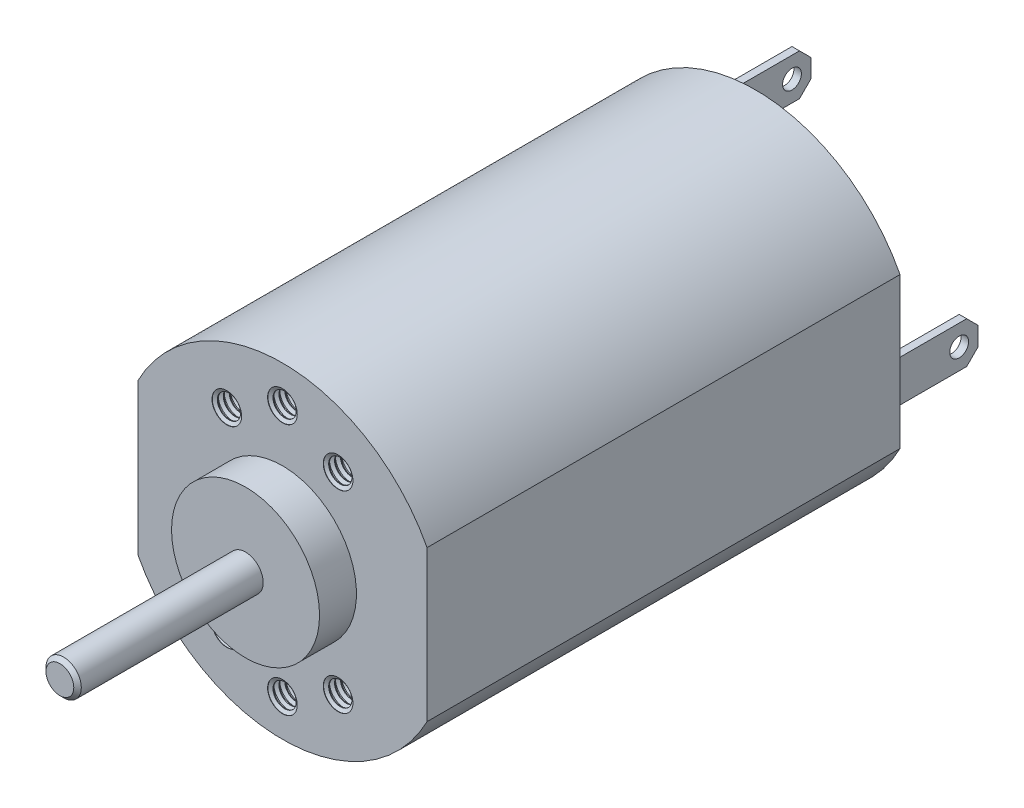
from build123d import *

# Parameters (mm, degrees)
SKETCH1_R            = 4.9911
EXTRUDE1_DEPTH       = 2.4892
EXTRUDE2_DEPTH       = 31.9024
SKETCH3_R            = 1.190625
EXTRUDE3_DEPTH       = 15.0114
SKETCH4_W            = 0.508
SKETCH4_H            = 2.794
EXTRUDE4_DEPTH       = 9.1186
SKETCH5_R            = 0.635
CUT_EXTRUDE1_DEPTH   = 46.087182201
LPATTERN1_COUNT      = 2
LPATTERN1_PITCH      = 11.2776
LPATTERN1_COUNT_DIR2 = 2
LPATTERN1_PITCH_DIR2 = 10.0076
CIRPATTERN1_COUNT    = 2
CIRPATTERN2_COUNT    = 6
CHAMFER1_SIZE        = 0.254


with BuildPart() as part:
    # Sketch1 → Extrude1 (new body)
    with BuildSketch(Plane.XY):
        Circle(SKETCH1_R)
    extrude(amount=EXTRUDE1_DEPTH)

    # Sketch2 → Extrude2 (add)
    with BuildSketch(Plane(origin=(0, 0, 0), x_dir=(-1, 0, 0), z_dir=(0, 0, -1))):
        with BuildLine():
            Line((-9.7536, 5.082095068), (-9.7536, -5.082095068))
            ThreePointArc((-9.7536, -5.082095068), (0, -10.9982), (9.7536, -5.082095068))
            Line((9.7536, -5.082095068), (9.7536, 5.082095068))
            ThreePointArc((9.7536, 5.082095068), (0, 10.9982), (-9.7536, 5.082095068))
        make_face()
    extrude(amount=EXTRUDE2_DEPTH)

    # Sketch3 → Extrude3 (add)
    with BuildSketch(Plane.XY):
        Circle(SKETCH3_R)
    extrude(amount=EXTRUDE3_DEPTH)

    # Sketch4 → Extrude4 (add)
    with BuildSketch(Plane(origin=(0, 0, -31.9024), x_dir=(-1, 0, 0), z_dir=(0, 0, -1))):
        with Locations((5.6388, 5.0038)):
            Rectangle(SKETCH4_W, SKETCH4_H)
    extrude4 = extrude(amount=EXTRUDE4_DEPTH)

    # Sketch5 → Cut-Extrude1 (cut, through all)
    with BuildSketch(Plane(origin=(-5.3848, 0, 0), x_dir=(0, 0, -1), z_dir=(1, 0, 0))):
        with Locations((39.751, 5.0038)):
            Circle(SKETCH5_R)
        Polygon((40.259, 6.4008), (41.021, 6.4008), (41.021, 5.6388), align=None)
        Polygon((40.259, 3.6068), (41.021, 3.6068), (41.021, 4.3688), align=None)
    cut_extrude1 = extrude(amount=-CUT_EXTRUDE1_DEPTH, mode=Mode.SUBTRACT)

    # LPattern1: Extrude4, Cut-Extrude1 2 × 2, 2 skipped
    with Locations(*[(i * LPATTERN1_PITCH, -j * LPATTERN1_PITCH_DIR2, 0) for i in range(LPATTERN1_COUNT) for j in range(LPATTERN1_COUNT_DIR2) if (i, j) not in ((0, 0), (0, 1), (1, 0))]):
        add(extrude4)
        add(cut_extrude1, mode=Mode.SUBTRACT)

    # Sketch7 → Cut-Revolve1 (revolve, cut)
    with BuildSketch(Plane(origin=(0, 0, 0), x_dir=(0, 0, -1), z_dir=(1, 0, 0)), mode=Mode.PRIVATE) as cut_revolve1_sk:
        Polygon((-0.2028, 8.4963), (2.9972, 8.4963), (2.9972, 9.279793649), (2.9472, 9.279793649), (2.8222, 9.4963), (2.7222, 9.4963), (2.5972, 9.279793649), (2.5472, 9.279793649), (2.4222, 9.4963), (2.3222, 9.4963), (2.1972, 9.279793649), (2.1472, 9.279793649), (2.0222, 9.4963), (1.9222, 9.4963), (1.7972, 9.279793649), (1.7472, 9.279793649), (1.6222, 9.4963), (1.5222, 9.4963), (1.3972, 9.279793649), (1.3472, 9.279793649), (1.2222, 9.4963), (1.1222, 9.4963), (0.9972, 9.279793649), (0.9472, 9.279793649), (0.8222, 9.4963), (0.7222, 9.4963), (0.5972, 9.279793649), (0.5472, 9.279793649), (0.4222, 9.4963), (0.3222, 9.4963), (0.1972, 9.279793649), (0.1472, 9.279793649), (0.0222, 9.4963), (-0.0778, 9.4963), (-0.2028, 9.279793649), align=None)
    cut_revolve1 = revolve(cut_revolve1_sk.sketch.rotate(Axis((0, 8.4963, 2.393928666), (0, 0, -1)), 90), axis=Axis((0, 8.4963, 2.393928666), (0, 0, -1)), mode=Mode.SUBTRACT)

    # CirPattern1: Cut-Revolve1 ×2 about axis
    cirpattern1_axis = Axis((0, 0, 0), (0, 0, 1))
    for i in range(1, CIRPATTERN1_COUNT):
        add(cut_revolve1.rotate(cirpattern1_axis, i * 360 / CIRPATTERN1_COUNT), mode=Mode.SUBTRACT)

    # Sketch8 → Cut-Revolve2 (revolve, cut)
    with BuildSketch(Plane(origin=(0, 0, 0), x_dir=(0, 0, -1), z_dir=(0.866025403784438, -0.500000000000001, 0)), mode=Mode.PRIVATE) as cut_revolve2_sk:
        Polygon((-0.2028, 7.5057), (2.9972, 7.5057), (2.9972, 8.289193649), (2.9472, 8.289193649), (2.8222, 8.5057), (2.7222, 8.5057), (2.5972, 8.289193649), (2.5472, 8.289193649), (2.4222, 8.5057), (2.3222, 8.5057), (2.1972, 8.289193649), (2.1472, 8.289193649), (2.0222, 8.5057), (1.9222, 8.5057), (1.7972, 8.289193649), (1.7472, 8.289193649), (1.6222, 8.5057), (1.5222, 8.5057), (1.3972, 8.289193649), (1.3472, 8.289193649), (1.2222, 8.5057), (1.1222, 8.5057), (0.9972, 8.289193649), (0.9472, 8.289193649), (0.8222, 8.5057), (0.7222, 8.5057), (0.5972, 8.289193649), (0.5472, 8.289193649), (0.4222, 8.5057), (0.3222, 8.5057), (0.1972, 8.289193649), (0.1472, 8.289193649), (0.0222, 8.5057), (-0.0778, 8.5057), (-0.2028, 8.289193649), align=None)
    cut_revolve2 = revolve(cut_revolve2_sk.sketch.rotate(Axis((3.75285, 6.500126873, 3.686969495), (0, 0, -1)), 60), axis=Axis((3.75285, 6.500126873, 3.686969495), (0, 0, -1)), mode=Mode.SUBTRACT)

    # CirPattern2: Cut-Revolve2 ×6 about axis, 2 skipped
    cirpattern2_axis = Axis((0, 0, 0), (0, 0, 1))
    add([cut_revolve2.rotate(cirpattern2_axis, i * 360 / CIRPATTERN2_COUNT) for i in range(1, CIRPATTERN2_COUNT) if i not in (2, 5)], mode=Mode.SUBTRACT)

    # Chamfer1
    chamfer1_edges = [part.edges().sort_by_distance(p)[0] for p in [
        (-1.190625, 0, 15.0114),
    ]]
    chamfer(chamfer1_edges, length=CHAMFER1_SIZE)


solid = part.part
